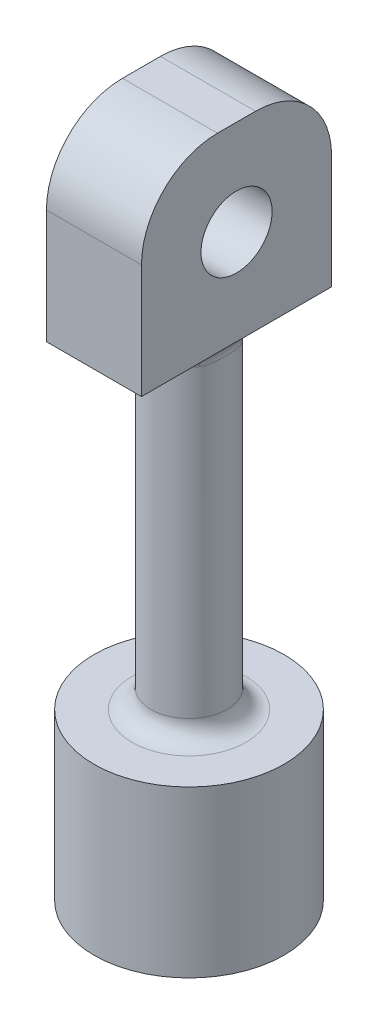
from build123d import *

# Parameters (mm, degrees)
SKETCH1_R           = 0.25
BOSS_EXTRUDE1_DEPTH = 0.435
SKETCH2_R           = 0.1
BOSS_EXTRUDE2_DEPTH = 0.9
SKETCH3_W           = 0.25
SKETCH3_H           = 0.5
BOSS_EXTRUDE3_DEPTH = 0.5
FILLET2_R           = 0.2
SKETCH4_R           = 0.0935
CUT_EXTRUDE1_DEPTH  = 0.25
FILLET3_R           = 0.05


with BuildPart() as part:
    # Sketch1 → Boss-Extrude1 (new body)
    with BuildSketch(Plane(origin=(0, 0, 0), x_dir=(1, 0, 0), z_dir=(0, 1, 0))):
        with Locations(Location((0, 0, 0), (0, 0, 270))):
            Circle(SKETCH1_R)
    extrude(amount=BOSS_EXTRUDE1_DEPTH)

    # Sketch2 → Boss-Extrude2 (add)
    with BuildSketch(Plane(origin=(0, 0.435, 0), x_dir=(1, 0, 0), z_dir=(0, 1, 0))):
        with Locations(Location((0, 0, 0), (0, 0, 270))):
            Circle(SKETCH2_R)
    extrude(amount=BOSS_EXTRUDE2_DEPTH)

    # Sketch3 → Boss-Extrude3 (add)
    with BuildSketch(Plane(origin=(0, 1.335, 0), x_dir=(1, 0, 0), z_dir=(0, 1, 0))):
        Rectangle(SKETCH3_W, SKETCH3_H)
    extrude(amount=BOSS_EXTRUDE3_DEPTH)

    # Fillet2
    fillet2_edges = [part.edges().sort_by_distance(p)[0] for p in [
        (0, 1.835, -0.25),
        (0, 1.835, 0.25),
    ]]
    fillet(fillet2_edges, radius=FILLET2_R)

    # Sketch4 → Cut-Extrude1 (cut)
    with BuildSketch(Plane(origin=(0.125, 0, 0), x_dir=(0, 0, -1), z_dir=(1, 0, 0))):
        with Locations((0, 1.585)):
            Circle(SKETCH4_R)
    extrude(amount=-CUT_EXTRUDE1_DEPTH, mode=Mode.SUBTRACT)

    # Fillet3
    fillet3_edges = [part.edges().sort_by_distance(p)[0] for p in [
        (0, 0.435, -0.1),
        (0, 1.335, -0.1),
    ]]
    fillet(fillet3_edges, radius=FILLET3_R)


solid = part.part
